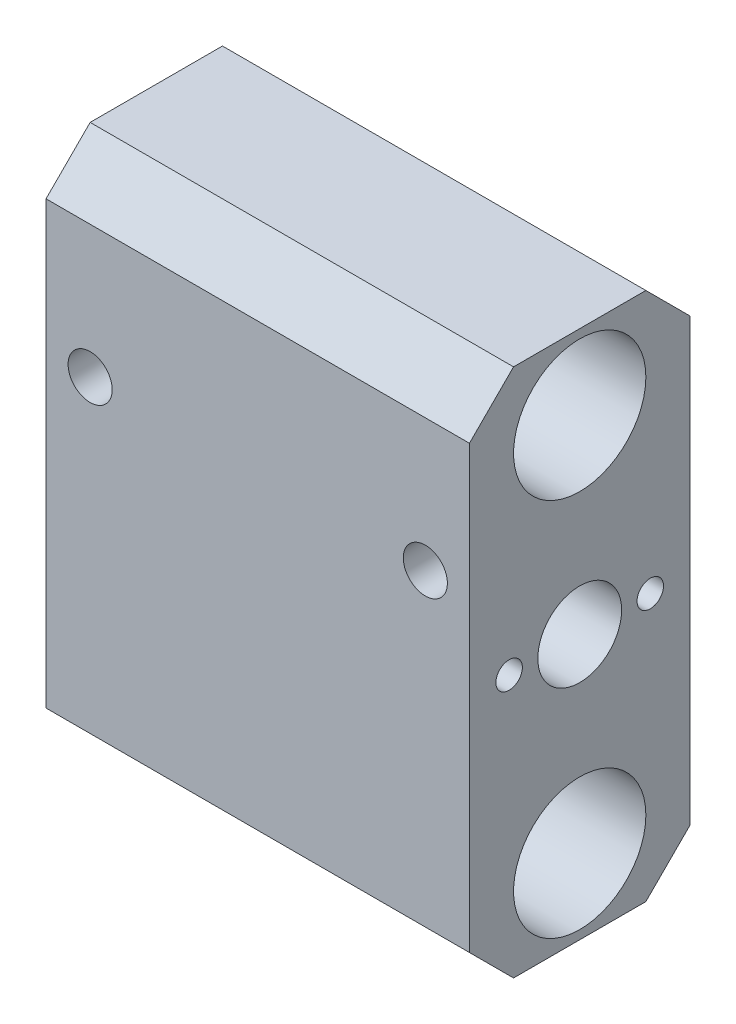
from build123d import *

# Parameters (mm, degrees)
SKETCH_1_W          = 25
SKETCH_1_H          = 60
SKETCH_1_R          = 4.75
SKETCH_1_R_2        = 7.5
EXTRUDE_1_DEPTH     = 48
SKETCH_2_R          = 1.5
CUT_EXTRUDE_1_DEPTH = 10
CUT_EXTRUDE_START   = -10
SKETCH_3_R          = 1.5
CUT_EXTRUDE_2_DEPTH = 10
CHAMFER_1_SIZE      = 5
SKETCH_4_R          = 2.5
CUT_EXTRUDE_3_DEPTH = 5
SKETCH_5_R          = 1.5
CUT_EXTRUDE_4_DEPTH = 5


with BuildPart() as part:
    # 草图1 → 凸台-拉伸1 (new body)
    with BuildSketch(Plane(origin=(0, 0, 0), x_dir=(0, 0, -1), z_dir=(1, 0, 0))):
        Rectangle(SKETCH_1_W, SKETCH_1_H)
        Circle(SKETCH_1_R, mode=Mode.SUBTRACT)
        with Locations((0, 21.5)):
            Circle(SKETCH_1_R_2, mode=Mode.SUBTRACT)
        with Locations((0, -21.5)):
            Circle(SKETCH_1_R_2, mode=Mode.SUBTRACT)
    extrude(amount=EXTRUDE_1_DEPTH)

    # 草图2 → 切除-拉伸1 (cut)
    with BuildSketch(Plane.ZY):
        with Locations((8, 0)):
            Circle(SKETCH_2_R)
        with Locations((-8, 0)):
            Circle(SKETCH_2_R)
    extrude(amount=-CUT_EXTRUDE_1_DEPTH, mode=Mode.SUBTRACT)

    # 草图3 → 切除-拉伸2 (cut)
    with BuildSketch(Plane(origin=(48, 0, 0), x_dir=(0, 0, -1), z_dir=(1, 0, 0)).offset(CUT_EXTRUDE_START)):
        with Locations(Location((8, 0, 0), (0, 0, 180))):
            Circle(SKETCH_3_R)
        with Locations(Location((-8, 0, 0), (0, 0, 180))):
            Circle(SKETCH_3_R)
    extrude(amount=CUT_EXTRUDE_2_DEPTH, mode=Mode.SUBTRACT)

    # 倒角1
    chamfer_1_edges = [part.edges().sort_by_distance(p)[0] for p in [
        (24, 30, 12.5),
        (24, 30, -12.5),
        (24, -30, -12.5),
        (24, -30, 12.5),
    ]]
    chamfer(chamfer_1_edges, length=CHAMFER_1_SIZE)

    # 草图4 → 切除-拉伸3 (cut)
    with BuildSketch(Plane.XY.offset(12.5)):
        with Locations((5, 10)):
            Circle(SKETCH_4_R)
        with Locations(Location((43, 10, 0), (0, 0, 180))):
            Circle(SKETCH_4_R)
    extrude(amount=-CUT_EXTRUDE_3_DEPTH, mode=Mode.SUBTRACT)

    # 草图5 → 切除-拉伸4 (cut)
    with BuildSketch(Plane(origin=(0, 0, -12.5), x_dir=(-1, 0, 0), z_dir=(0, 0, -1))):
        with Locations(Location((-10, 9.5, 0), (0, 0, 90))):
            Circle(SKETCH_5_R)
        with Locations(Location((-10, -9.5, 0), (0, 0, 270))):
            Circle(SKETCH_5_R)
    extrude(amount=-CUT_EXTRUDE_4_DEPTH, mode=Mode.SUBTRACT)


solid = part.part
